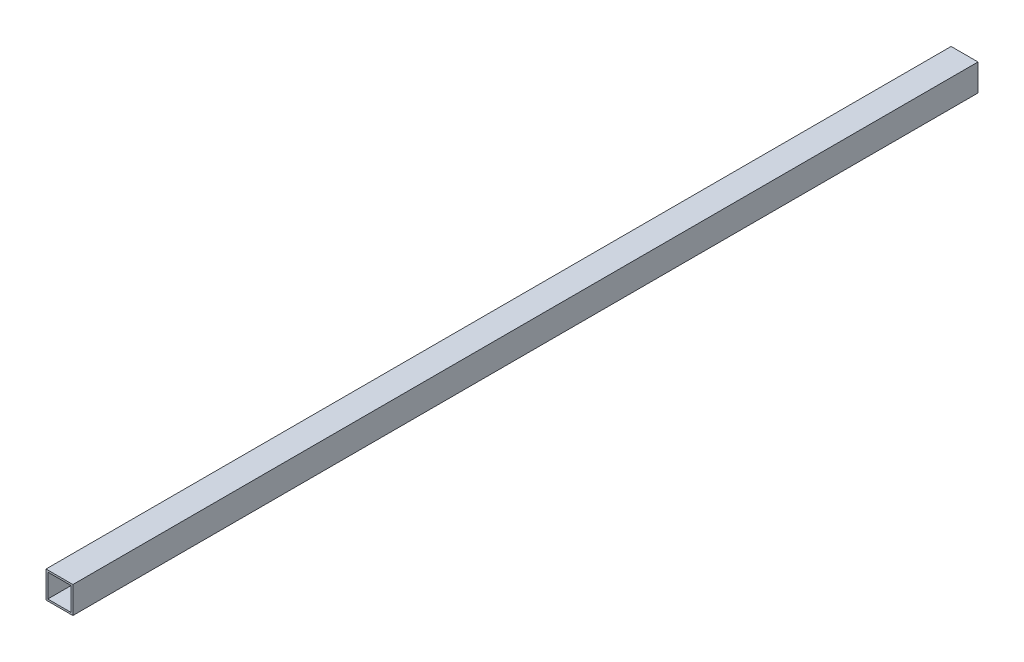
from build123d import *

# Parameters (mm, degrees)
CROQUIS1_W            = 30
CROQUIS1_H            = 30
CROQUIS1_W_2          = 26
CROQUIS1_H_2          = 26
EXTRUIR_L_MINA1_DEPTH = 1010


with BuildPart() as part:
    # Croquis1 → Extruir-Lámina1 (new body)
    with BuildSketch(Plane.XY):
        Rectangle(CROQUIS1_W, CROQUIS1_H)
        Rectangle(CROQUIS1_W_2, CROQUIS1_H_2, mode=Mode.SUBTRACT)
    extrude(amount=EXTRUIR_L_MINA1_DEPTH)


solid = part.part
